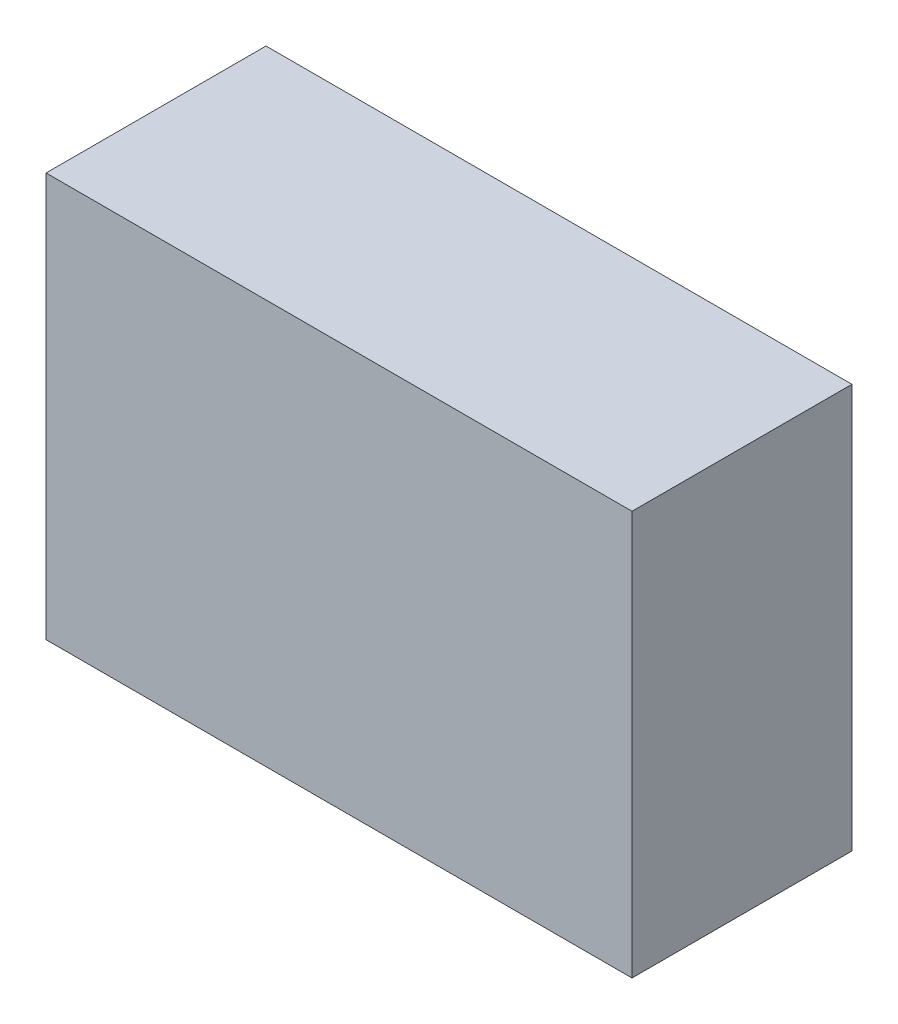
from build123d import *

# Parameters (mm, degrees)
SKETCH1_W           = 58.0644
SKETCH1_H           = 40.0558
BOSS_EXTRUDE1_DEPTH = 21.7932


with BuildPart() as part:
    # Sketch1 → Boss-Extrude1 (new body)
    with BuildSketch(Plane.XY):
        Rectangle(SKETCH1_W, SKETCH1_H)
    extrude(amount=BOSS_EXTRUDE1_DEPTH)


solid = part.part
